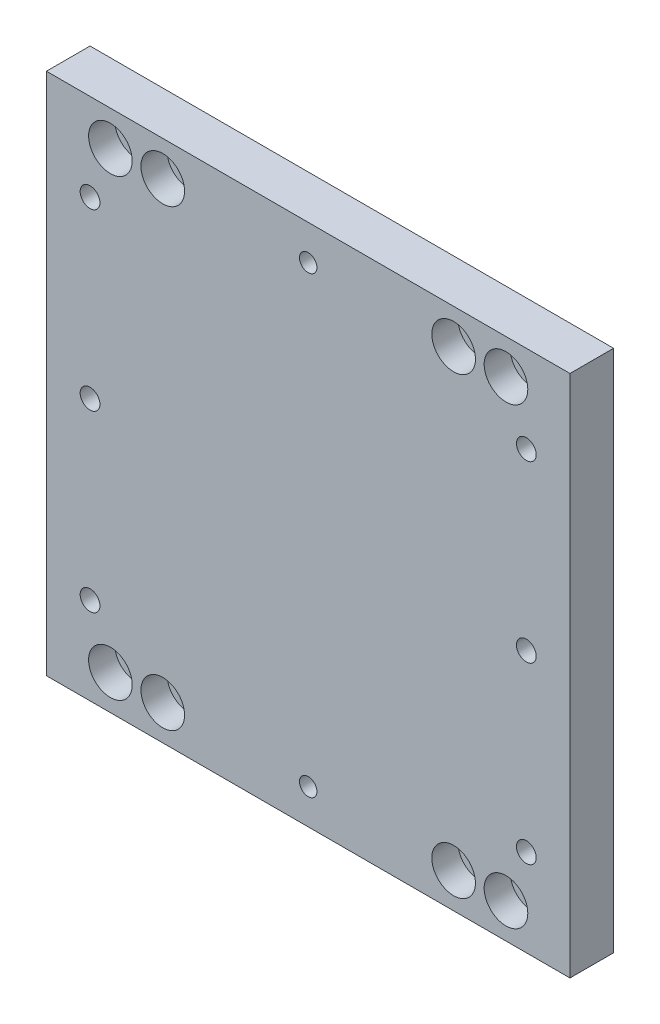
from build123d import *

# Parameters (mm, degrees)
SKETCH_1_W                    = 180
SKETCH_1_H                    = 180
EXTRUDE_1_DEPTH               = 15
HOLE_WIZARD_4_8_1_D           = 9
HOLE_WIZARD_4_8_1_CBORE_D     = 15
HOLE_WIZARD_4_8_1_CBORE_DEPTH = 9
HOLE_WIZARD_6_0_6_1_D         = 6
HOLE_WIZARD_M8_1_D            = 6.8
HOLE_WIZARD_M8_1_DEPTH        = 22.25
HOLE_WIZARD_M8_1_TIP          = 2.042926105


with BuildPart() as part:
    # 草图1 → 凸台-拉伸1 (new body)
    with BuildSketch(Plane.XY):
        Rectangle(SKETCH_1_W, SKETCH_1_H)
    extrude(amount=EXTRUDE_1_DEPTH)

    # 打孔尺寸根据内六角花形圆柱头螺钉-4.8级的类型1 (through all)
    with Locations(Plane(origin=(-68, -78, 15), x_dir=(1, 0, 0), z_dir=(0, 0, 1))):
        with Locations((0, 0), (18, 0), (118, 0), (136, 0), (136, 156), (118, 156), (18, 156), (0, 156)):
            CounterBoreHole(HOLE_WIZARD_4_8_1_D / 2, HOLE_WIZARD_4_8_1_CBORE_D / 2, HOLE_WIZARD_4_8_1_CBORE_DEPTH)

    # Ø6.0 (6) 直径孔1 (through all)
    with Locations(Plane(origin=(0, 78, 15), x_dir=(1, 0, 0), z_dir=(0, 0, 1))):
        with Locations((0, 0), (0, -156)):
            Hole(HOLE_WIZARD_6_0_6_1_D / 2)

    # M8 螺纹孔1
    with Locations(Plane(origin=(-75, 60, 15), x_dir=(1, 0, 0), z_dir=(0, 0, 1))):
        with Locations((0, 0), (0, -60), (0, -120), (150, -120), (150, -60), (150, 0)):
            Hole(HOLE_WIZARD_M8_1_D / 2, depth=HOLE_WIZARD_M8_1_DEPTH)
            with Locations((0, 0, -(HOLE_WIZARD_M8_1_DEPTH + HOLE_WIZARD_M8_1_TIP / 2))):  # 118° drill point
                Cone(0, HOLE_WIZARD_M8_1_D / 2, HOLE_WIZARD_M8_1_TIP, mode=Mode.SUBTRACT)


solid = part.part
